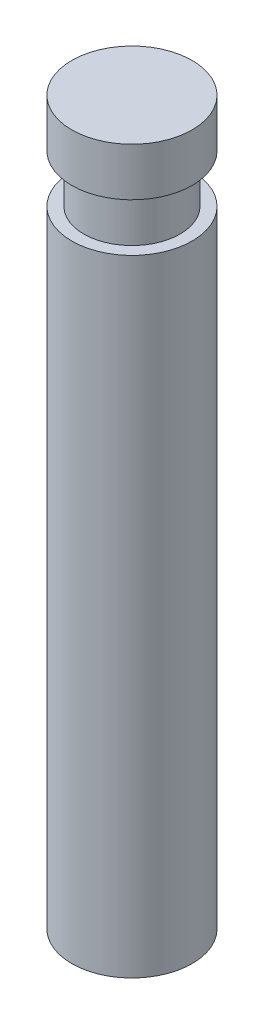
from build123d import *

# Parameters (mm, degrees)
SKETCH1_R           = 2.5
BOSS_EXTRUDE1_DEPTH = 26
SKETCH1_5_R         = 1
CUT_EXTRUDE1_DEPTH  = 10
SKETCH3_R           = 2
BOSS_EXTRUDE2_DEPTH = 2
SKETCH4_R           = 2.5
BOSS_EXTRUDE3_DEPTH = 2


with BuildPart() as part:
    # Sketch1 → Boss-Extrude1 (new body)
    with BuildSketch(Plane(origin=(0, 0, 0), x_dir=(1, 0, 0), z_dir=(0, 1, 0))):
        Circle(SKETCH1_R)
    extrude(amount=BOSS_EXTRUDE1_DEPTH)

    # Sketch1<5> → Cut-Extrude1 (cut)
    with BuildSketch(Plane(origin=(0, 0, 0), x_dir=(1, 0, 0), z_dir=(0, 1, 0))):
        Circle(SKETCH1_5_R)
    extrude(amount=CUT_EXTRUDE1_DEPTH, mode=Mode.SUBTRACT)

    # Sketch3 → Boss-Extrude2 (add)
    with BuildSketch(Plane(origin=(0, 26, 0), x_dir=(1, 0, 0), z_dir=(0, 1, 0))):
        Circle(SKETCH3_R)
    extrude(amount=BOSS_EXTRUDE2_DEPTH)

    # Sketch4 → Boss-Extrude3 (add)
    with BuildSketch(Plane(origin=(0, 28, 0), x_dir=(1, 0, 0), z_dir=(0, 1, 0))):
        Circle(SKETCH4_R)
    extrude(amount=BOSS_EXTRUDE3_DEPTH)


solid = part.part
